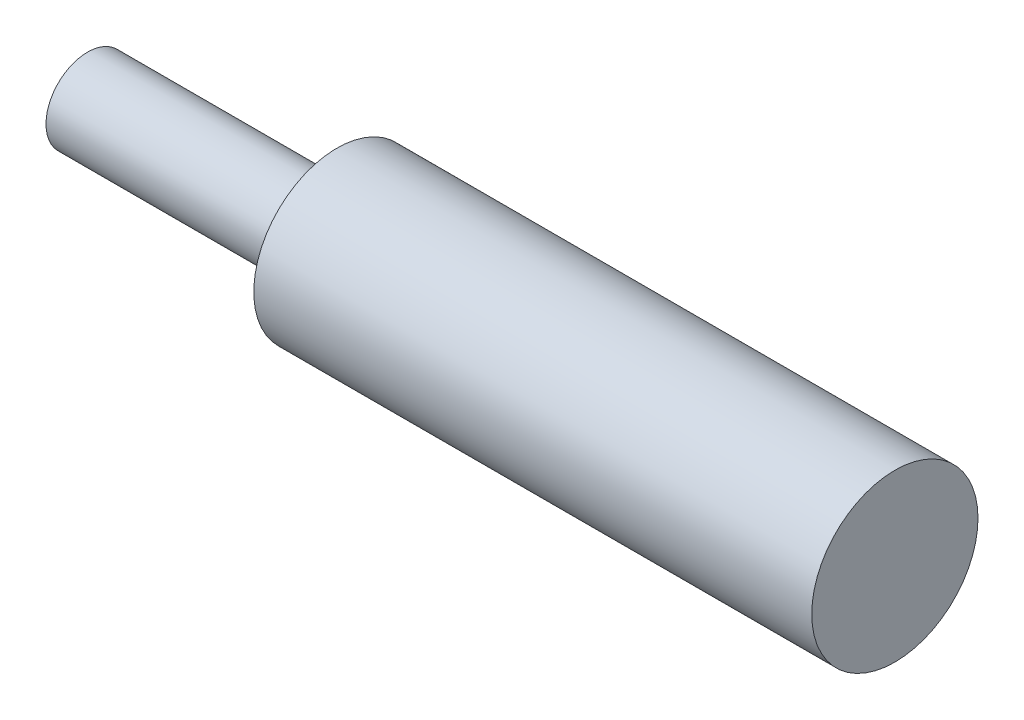
from build123d import *

# Parameters (mm, degrees)
SKETCH3_R           = 4
BASE_EXTRUDE_DEPTH  = 77.7
SKETCH4_R           = 8
BOSS_EXTRUDE1_DEPTH = 53.7


with BuildPart() as part:
    # Sketch3 → Base-Extrude (new body)
    with BuildSketch(Plane.ZY.offset(-2753.793651439)):
        with Locations((23.734, 11.5)):
            Circle(SKETCH3_R)
    extrude(amount=-BASE_EXTRUDE_DEPTH)

    # Sketch4 → Boss-Extrude1 (add)
    with BuildSketch(Plane.ZY.offset(-2831.493651439)):
        with Locations(Location((23.734, 11.5, 0), (0, 0, 180))):
            Circle(SKETCH4_R)
    extrude(amount=BOSS_EXTRUDE1_DEPTH)


solid = part.part
